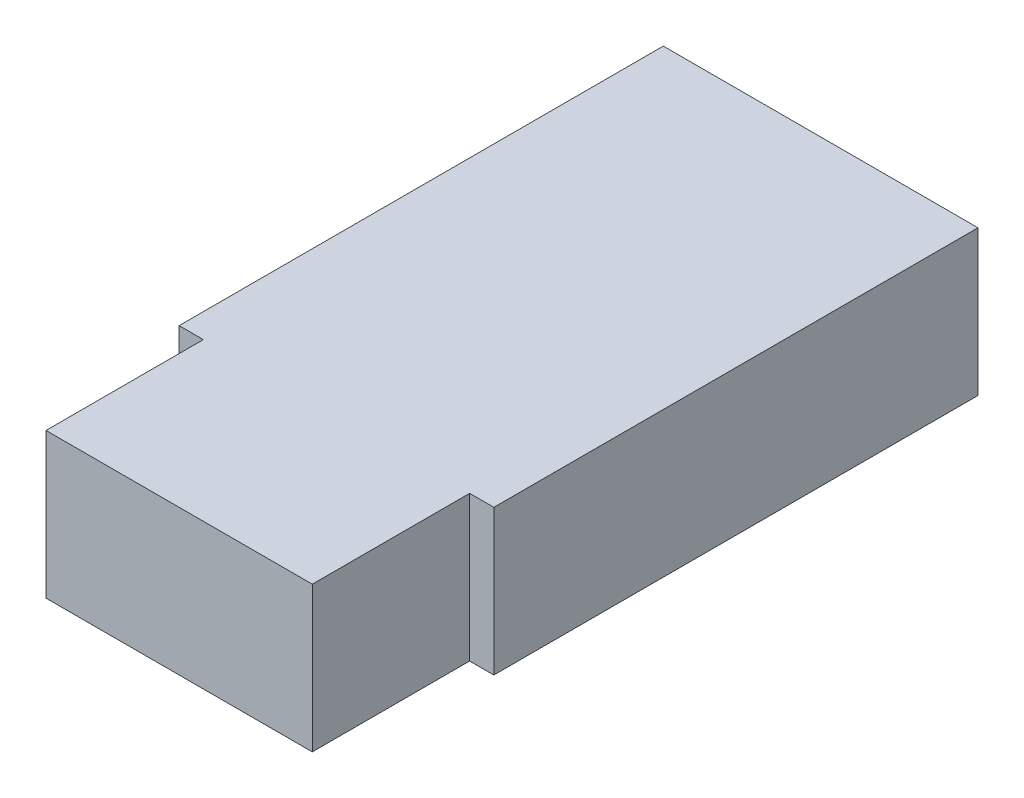
from build123d import *

# Parameters (mm, degrees)
BOSS_EXTRUDE1_DEPTH = 12


with BuildPart() as part:
    # Sketch1 → Boss-Extrude1 (new body)
    with BuildSketch(Plane(origin=(0, 0, 0), x_dir=(1, 0, 0), z_dir=(0, 1, 0))):
        Polygon((11, -20), (13, -20), (13, 20), (-13, 20), (-13, -20), (-11, -20), (-11, -33), (11, -33), align=None)
    extrude(amount=BOSS_EXTRUDE1_DEPTH)


solid = part.part
